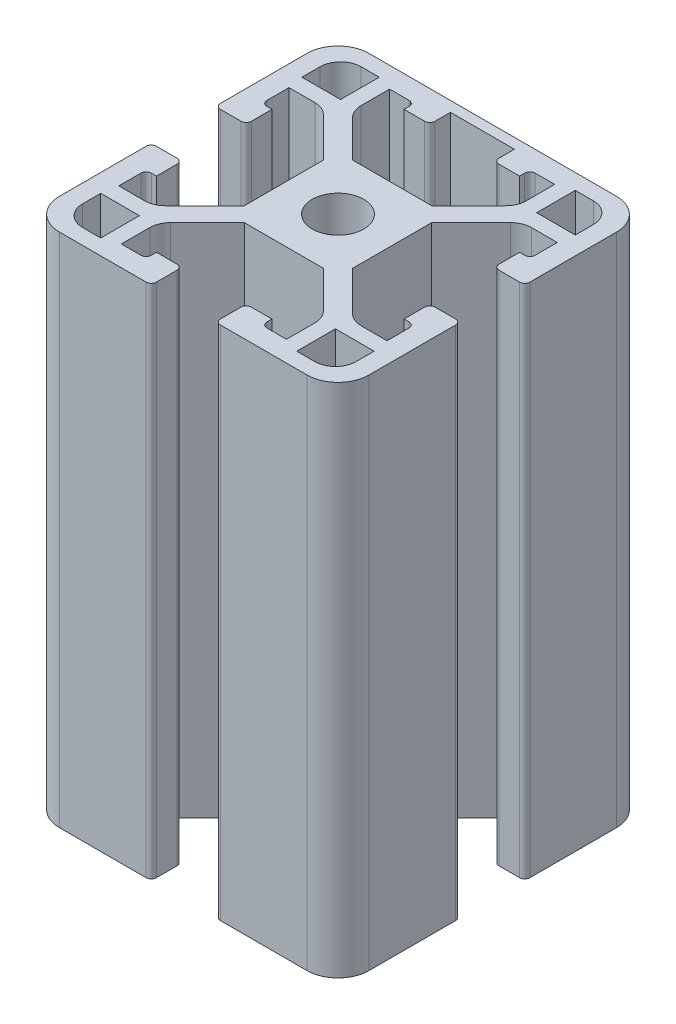
from build123d import *

# Parameters (mm, degrees)
SKETCH2_R           = 2.5
BOSS_EXTRUDE1_DEPTH = 50


with BuildPart() as part:
    # Sketch2 → Boss-Extrude1 (new body)
    with BuildSketch(Plane(origin=(0, 0, 0), x_dir=(1, 0, 0), z_dir=(0, 1, 0))):
        with BuildLine():
            Line((3.6, -15), (12, -15))
            ThreePointArc((12, -15), (14.121320344, -14.121320344), (15, -12))
            Line((15, -12), (15, -3.6))
            ThreePointArc((15, -3.6), (14.853553391, -3.246446609), (14.5, -3.1))
            Line((14.5, -3.1), (12.5, -3.1))
            ThreePointArc((12.5, -3.1), (12.146446609, -3.246446609), (12, -3.6))
            Line((12, -3.6), (12, -5.6))
            Line((12, -5.6), (12.5, -5.6))
            ThreePointArc((12.5, -5.6), (12.853553391, -5.746446609), (13, -6.1))
            Line((13, -6.1), (13, -8.25))
            Line((13, -8.25), (10.492640687, -8.25))
            ThreePointArc((10.492640687, -8.25), (9.727273822, -8.097759065), (9.078427125, -7.664213562))
            Line((9.078427125, -7.664213562), (5.25, -3.835786438))
            Line((5.25, -3.835786438), (5.25, 3.835786438))
            Line((5.25, 3.835786438), (9.078427125, 7.664213562))
            ThreePointArc((9.078427125, 7.664213562), (9.727273822, 8.097759065), (10.492640687, 8.25))
            Line((10.492640687, 8.25), (13, 8.25))
            Line((13, 8.25), (13, 6.1))
            ThreePointArc((13, 6.1), (12.853553391, 5.746446609), (12.5, 5.6))
            Line((12.5, 5.6), (12, 5.6))
            Line((12, 5.6), (12, 3.6))
            ThreePointArc((12, 3.6), (12.146446609, 3.246446609), (12.5, 3.1))
            Line((12.5, 3.1), (14.5, 3.1))
            ThreePointArc((14.5, 3.1), (14.853553391, 3.246446609), (15, 3.6))
            Line((15, 3.6), (15, 12))
            ThreePointArc((15, 12), (14.121320344, 14.121320344), (12, 15))
            Line((12, 15), (-12, 15))
            ThreePointArc((-12, 15), (-14.121320344, 14.121320344), (-15, 12))
            Line((-15, 12), (-15, 3.6))
            ThreePointArc((-15, 3.6), (-14.853553391, 3.246446609), (-14.5, 3.1))
            Line((-14.5, 3.1), (-12.5, 3.1))
            ThreePointArc((-12.5, 3.1), (-12.146446609, 3.246446609), (-12, 3.6))
            Line((-12, 3.6), (-12, 5.6))
            Line((-12, 5.6), (-12.5, 5.6))
            ThreePointArc((-12.5, 5.6), (-12.853553391, 5.746446609), (-13, 6.1))
            Line((-13, 6.1), (-13, 8.25))
            Line((-13, 8.25), (-10.492640687, 8.25))
            ThreePointArc((-10.492640687, 8.25), (-9.727273822, 8.097759065), (-9.078427125, 7.664213562))
            Line((-9.078427125, 7.664213562), (-5.25, 3.835786438))
            Line((-5.25, 3.835786438), (-5.25, -3.835786438))
            Line((-5.25, -3.835786438), (-9.078427125, -7.664213562))
            ThreePointArc((-9.078427125, -7.664213562), (-9.727273822, -8.097759065), (-10.492640687, -8.25))
            Line((-10.492640687, -8.25), (-13, -8.25))
            Line((-13, -8.25), (-13, -6.1))
            ThreePointArc((-13, -6.1), (-12.853553391, -5.746446609), (-12.5, -5.6))
            Line((-12.5, -5.6), (-12, -5.6))
            Line((-12, -5.6), (-12, -3.6))
            ThreePointArc((-12, -3.6), (-12.146446609, -3.246446609), (-12.5, -3.1))
            Line((-12.5, -3.1), (-14.5, -3.1))
            ThreePointArc((-14.5, -3.1), (-14.853553391, -3.246446609), (-15, -3.6))
            Line((-15, -3.6), (-15, -12))
            ThreePointArc((-15, -12), (-14.121320344, -14.121320344), (-12, -15))
            Line((-12, -15), (-3.6, -15))
            ThreePointArc((-3.6, -15), (-3.246446609, -14.853553391), (-3.1, -14.5))
            Line((-3.1, -14.5), (-3.1, -12.5))
            ThreePointArc((-3.1, -12.5), (-3.246446609, -12.146446609), (-3.6, -12))
            Line((-3.6, -12), (-5.6, -12))
            Line((-5.6, -12), (-5.6, -12.5))
            ThreePointArc((-5.6, -12.5), (-5.746446609, -12.853553391), (-6.1, -13))
            Line((-6.1, -13), (-8, -13))
            Line((-8, -13), (-8, -10.242640687))
            ThreePointArc((-8, -10.242640687), (-7.847759065, -9.477273822), (-7.414213562, -8.828427125))
            Line((-7.414213562, -8.828427125), (-3.835786438, -5.25))
            Line((-3.835786438, -5.25), (3.835786438, -5.25))
            Line((3.835786438, -5.25), (7.414213562, -8.828427125))
            ThreePointArc((7.414213562, -8.828427125), (7.847759065, -9.477273822), (8, -10.242640687))
            Line((8, -10.242640687), (8, -13))
            Line((8, -13), (6.1, -13))
            ThreePointArc((6.1, -13), (5.746446609, -12.853553391), (5.6, -12.5))
            Line((5.6, -12.5), (5.6, -12))
            Line((5.6, -12), (3.6, -12))
            ThreePointArc((3.6, -12), (3.246446609, -12.146446609), (3.1, -12.5))
            Line((3.1, -12.5), (3.1, -14.5))
            ThreePointArc((3.1, -14.5), (3.246446609, -14.853553391), (3.6, -15))
        make_face()
        with Locations(Location((0, 0, 0), (0, 0, 270))):
            Circle(SKETCH2_R, mode=Mode.SUBTRACT)
        with BuildLine():
            Line((-3.835786438, 5.25), (3.835786438, 5.25))
            Line((3.835786438, 5.25), (7.414213562, 8.828427125))
            ThreePointArc((7.414213562, 8.828427125), (7.847759065, 9.477273822), (8, 10.242640687))
            Line((8, 10.242640687), (8, 13))
            Line((8, 13), (6.1, 13))
            ThreePointArc((6.1, 13), (5.746446609, 12.853553391), (5.6, 12.5))
            Line((5.6, 12.5), (5.6, 12))
            Line((5.6, 12), (3.6, 12))
            ThreePointArc((3.6, 12), (3.246446609, 12.146446609), (3.1, 12.5))
            Line((3.1, 12.5), (3.1, 14))
            Line((3.1, 14), (-3.1, 14))
            Line((-3.1, 14), (-3.1, 12.5))
            ThreePointArc((-3.1, 12.5), (-3.246446609, 12.146446609), (-3.6, 12))
            Line((-3.6, 12), (-5.6, 12))
            Line((-5.6, 12), (-5.6, 12.5))
            ThreePointArc((-5.6, 12.5), (-5.746446609, 12.853553391), (-6.1, 13))
            Line((-6.1, 13), (-8, 13))
            Line((-8, 13), (-8, 10.242640687))
            ThreePointArc((-8, 10.242640687), (-7.847759065, 9.477273822), (-7.414213562, 8.828427125))
            Line((-7.414213562, 8.828427125), (-3.835786438, 5.25))
        make_face(mode=Mode.SUBTRACT)
        with BuildLine():
            Line((9.5, -9.75), (13.25, -9.75))
            Line((13.25, -9.75), (13.25, -11.5))
            ThreePointArc((13.25, -11.5), (12.664213562, -12.914213562), (11.25, -13.5))
            Line((11.25, -13.5), (9.5, -13.5))
            Line((9.5, -13.5), (9.5, -9.75))
        make_face(mode=Mode.SUBTRACT)
        with BuildLine():
            Line((-13.25, -9.75), (-13.25, -11.5))
            ThreePointArc((-13.25, -11.5), (-12.664213562, -12.914213562), (-11.25, -13.5))
            Line((-11.25, -13.5), (-9.5, -13.5))
            Line((-9.5, -13.5), (-9.5, -9.75))
            Line((-9.5, -9.75), (-13.25, -9.75))
        make_face(mode=Mode.SUBTRACT)
        with BuildLine():
            Line((-9.5, 9.75), (-13.25, 9.75))
            Line((-13.25, 9.75), (-13.25, 11.5))
            ThreePointArc((-13.25, 11.5), (-12.664213562, 12.914213562), (-11.25, 13.5))
            Line((-11.25, 13.5), (-9.5, 13.5))
            Line((-9.5, 13.5), (-9.5, 9.75))
        make_face(mode=Mode.SUBTRACT)
        with BuildLine():
            Line((13.25, 9.75), (13.25, 11.5))
            ThreePointArc((13.25, 11.5), (12.664213562, 12.914213562), (11.25, 13.5))
            Line((11.25, 13.5), (9.5, 13.5))
            Line((9.5, 13.5), (9.5, 9.75))
            Line((9.5, 9.75), (13.25, 9.75))
        make_face(mode=Mode.SUBTRACT)
    extrude(amount=BOSS_EXTRUDE1_DEPTH)


solid = part.part
